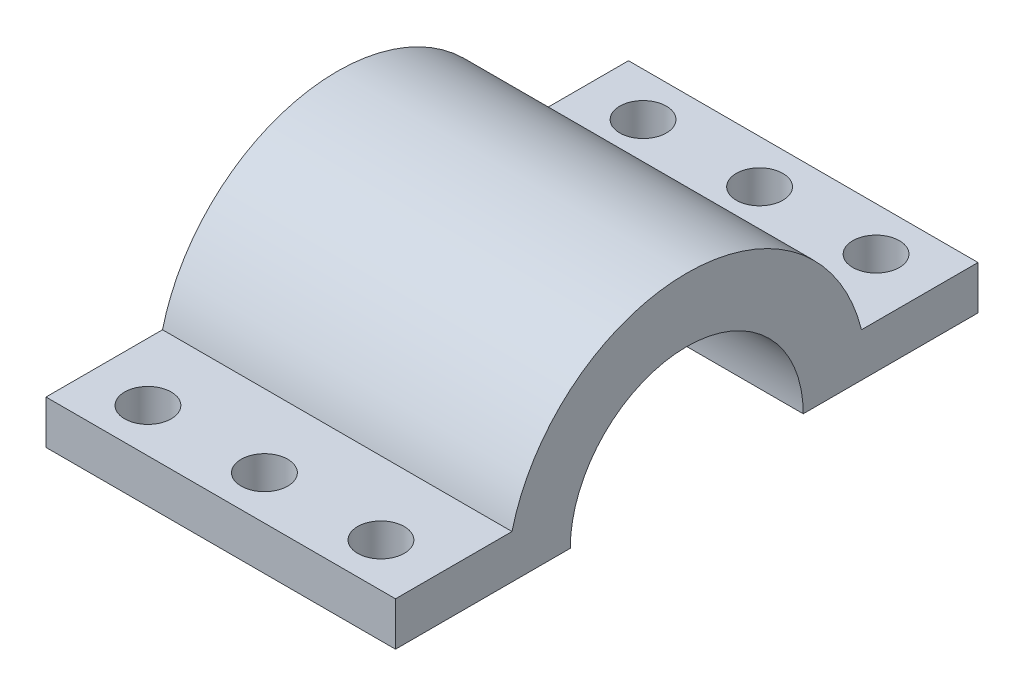
from build123d import *

# Parameters (mm, degrees)
SKETCH_1_W          = 16
SKETCH_1_H          = 16
EXTRUDE_1_DEPTH     = 20
SKETCH_2_W          = 24
SKETCH_2_H          = 24
EXTRUDE_4_DEPTH     = 10
SKETCH_3_W          = 4
SKETCH_3_H          = 3
EXTRUDE_6_DEPTH     = 24
SKETCH_5_R          = 1.6
CUT_EXTRUDE_1_DEPTH = 24
CUT_EXTRUDE_2_DEPTH = 24


with BuildPart() as part:
    # 草图1 → 凸台-拉伸1 (new body)
    with BuildSketch(Plane(origin=(0, 0, 0), x_dir=(1, 0, 0), z_dir=(0, 1, 0))):
        Polygon((-4, 20), (-4, 16), (-4, -4), (16, -4), (20, -4), (20, 0), (20, 20), (0, 20), align=None)
        with Locations((8, 8)):
            Rectangle(SKETCH_1_W, SKETCH_1_H, mode=Mode.SUBTRACT)
    extrude(amount=-EXTRUDE_1_DEPTH)

    # 草图2 → 凸台-拉伸4 (add)
    with BuildSketch(Plane.XZ.offset(20)):
        with Locations((8, -8)):
            Rectangle(SKETCH_2_W, SKETCH_2_H)
    extrude(amount=EXTRUDE_4_DEPTH)

    # 草图3 → 凸台-拉伸6 (add)
    with BuildSketch(Plane.ZY.offset(4)):
        with Locations((10, -36.5)):
            Rectangle(SKETCH_3_W, SKETCH_3_H)
        with BuildLine():
            Line((4, -35), (4, -30))
            Line((4, -30), (-8.000000062, -30))
            ThreePointArc((-8.000000062, -30), (-2.343145773, -32.343145728), (0, -38))
            Line((0, -38), (8, -38))
            Line((8, -38), (8, -35))
            Line((8, -35), (4, -35))
        make_face()
        with BuildLine():
            ThreePointArc((-16, -38), (-13.656854272, -32.343145773), (-8.000000062, -30))
            Line((-8.000000062, -30), (-20, -30))
            Line((-20, -30), (-20, -35))
            Line((-20, -35), (-24, -35))
            Line((-24, -35), (-24, -38))
            Line((-24, -38), (-16, -38))
        make_face()
        with Locations((-26, -36.5)):
            Rectangle(SKETCH_3_W, SKETCH_3_H)
    extrude(amount=-EXTRUDE_6_DEPTH)

    # 草图5 → 切除-拉伸1 (cut)
    with BuildSketch(Plane.XZ.offset(38)):
        with Locations(Location((8, 9, 0), (0, 0, 270))):
            Circle(SKETCH_5_R)
        with Locations(Location((16, 9, 0), (0, 0, 270))):
            Circle(SKETCH_5_R)
        with Locations(Location((0, 9, 0), (0, 0, 90))):
            Circle(SKETCH_5_R)
        with Locations(Location((0, -25, 0), (0, 0, 270))):
            Circle(SKETCH_5_R)
        with Locations(Location((8, -25, 0), (0, 0, 270))):
            Circle(SKETCH_5_R)
        with Locations(Location((16, -25, 0), (0, 0, 270))):
            Circle(SKETCH_5_R)
    extrude(amount=-CUT_EXTRUDE_1_DEPTH, mode=Mode.SUBTRACT)

    # 草图6 → 切除-拉伸2 (cut)
    with BuildSketch(Plane.ZY.offset(4)):
        with BuildLine():
            Line((-20, -35), (-20, 0))
            Line((-20, 0), (4, 0))
            Line((4, 0), (4, -35))
            ThreePointArc((4, -35), (-8, -25.630683123), (-20, -35))
        make_face()
    extrude(amount=-CUT_EXTRUDE_2_DEPTH, mode=Mode.SUBTRACT)


solid = part.part
